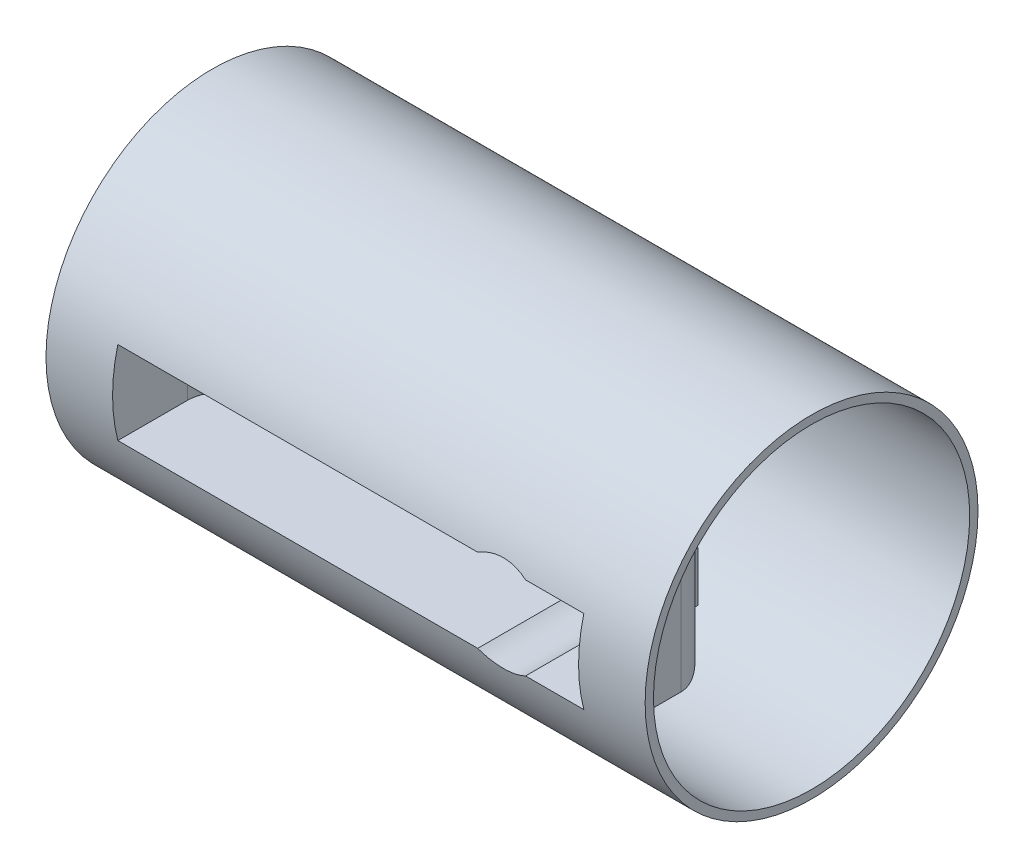
from build123d import *

# Parameters (mm, degrees)
SKETCH_1_W           = 300
SKETCH_1_H           = 100
SKETCH_2_R           = 95
CUT_EXTRUDE_1_DEPTH  = 332.662479036
EXTRUDE_START        = 60
SKETCH_5_R           = 100
SKETCH_5_R_2         = 95
EXTRUDE_1_DEPTH      = 60
SKETCH_6_W           = 280
SKETCH_6_H           = 50
CUT_EXTRUDE_2_DEPTH  = 10
EXTRUDE_3_DEPTH      = 290
EXTRUDE_3_DEPTH_BACK = 10
SKETCH_14_W          = 300
SKETCH_14_H          = 70
EXTRUDE_5_DEPTH      = 60
SKETCH_13_W          = 280
SKETCH_13_H          = 50
CUT_EXTRUDE_3_DEPTH  = 65
FILLET_1_R           = 20
EXTRUDE_6_DEPTH      = 10
SKETCH_16_W          = 36
SKETCH_16_H          = 20
CUT_EXTRUDE_4_DEPTH  = 10
SKETCH_17_R          = 28.835
CUT_EXTRUDE_5_DEPTH  = 344.838624939


with BuildPart() as part:
    # 草图1 → 旋转1 (revolve)
    with BuildSketch(Plane(origin=(0, 0, 0), x_dir=(1, 0, 0), z_dir=(0, 1, 0)), mode=Mode.PRIVATE) as revolve_1_sk:
        with Locations((-150, -50)):
            Rectangle(SKETCH_1_W, SKETCH_1_H)
    revolve(revolve_1_sk.sketch.rotate(Axis((0, 0, 0), (-1, 0, 0)), 180), axis=Axis((0, 0, 0), (-1, 0, 0)))

    # 草图2 → 切除-拉伸1 (cut, through all)
    with BuildSketch(Plane(origin=(0, 0, 0), x_dir=(0, 0, -1), z_dir=(1, 0, 0))):
        Circle(SKETCH_2_R)
    extrude(amount=-CUT_EXTRUDE_1_DEPTH, mode=Mode.SUBTRACT)

    # 草图5 → 凸台-拉伸1 (add)
    with BuildSketch(Plane(origin=(0, 0, 0), x_dir=(0, 0, -1), z_dir=(1, 0, 0)).offset(EXTRUDE_START)):
        Circle(SKETCH_5_R)
        Circle(SKETCH_5_R_2, mode=Mode.SUBTRACT)
    extrude(amount=-EXTRUDE_1_DEPTH)

    # 草图6 → 切除-拉伸2 (cut)
    with BuildSketch(Plane.XY.offset(100)):
        with Locations((-120, 0)):
            Rectangle(SKETCH_6_W, SKETCH_6_H)
    extrude(amount=-CUT_EXTRUDE_2_DEPTH, mode=Mode.SUBTRACT)

    # 草图9 → 凸台-拉伸3 (add, two sides: drawn at the far end of the back side and taken through both)
    with BuildSketch(Plane.ZY.offset(-20).offset(-EXTRUDE_3_DEPTH_BACK)):
        with BuildLine():
            Line((88.317608663, 35), (88.317608663, -35))
            ThreePointArc((88.317608663, -35), (95, 0), (88.317608663, 35))
        make_face()
    extrude(amount=EXTRUDE_3_DEPTH + EXTRUDE_3_DEPTH_BACK)

    # 草图14 → 凸台-拉伸5 (add)
    with BuildSketch(Plane(origin=(0, 0, 88.317608663), x_dir=(-1, 0, 0), z_dir=(0, 0, -1))):
        with Locations((120, 0)):
            Rectangle(SKETCH_14_W, SKETCH_14_H)
    extrude(amount=EXTRUDE_5_DEPTH)

    # 草图13 → 切除-拉伸3 (cut)
    with BuildSketch(Plane.XY.offset(100)):
        with Locations((-120, 0)):
            Rectangle(SKETCH_13_W, SKETCH_13_H)
    extrude(amount=-CUT_EXTRUDE_3_DEPTH, mode=Mode.SUBTRACT)

    # 圆角1
    fillet_1_edges = [part.edges().sort_by_distance(p)[0] for p in [
        (-270, 0, 28.317608663),
        (-120, 35, 28.317608663),
        (30, 0, 28.317608663),
        (-120, -35, 28.317608663),
        (-260, 0, 35),
        (20, 0, 35),
    ]]
    fillet(fillet_1_edges, radius=FILLET_1_R)

    # 草图15 → 凸台-拉伸6 (add)
    with BuildSketch(Plane(origin=(0, 0, 28.317608663), x_dir=(-1, 0, 0), z_dir=(0, 0, -1))):
        Polygon((-4.931797057, -10), (-4.931797057, 10), (31.068202943, 10), (31, 15), (-4.931797057, 15), (-10, 15), (-10, 10), (-10, -10), (-10, -15), (-4.931797057, -15), (31, -15), (31.068202943, -10), align=None)
    extrude(amount=EXTRUDE_6_DEPTH)

    # 草图16 → 切除-拉伸4 (cut)
    with BuildSketch(Plane(origin=(0, 0, 28.317608663), x_dir=(-1, 0, 0), z_dir=(0, 0, -1))):
        with Locations((13.068202943, 0)):
            Rectangle(SKETCH_16_W, SKETCH_16_H)
    extrude(amount=-CUT_EXTRUDE_4_DEPTH, mode=Mode.SUBTRACT)

    # 草图17 → 切除-拉伸5 (cut, through all)
    with BuildSketch(Plane(origin=(0, 0, 35), x_dir=(-1, 0, 0), z_dir=(0, 0, -1))):
        with Locations((29.4, 0)):
            Circle(SKETCH_17_R)
    extrude(amount=-CUT_EXTRUDE_5_DEPTH, mode=Mode.SUBTRACT)


solid = part.part
